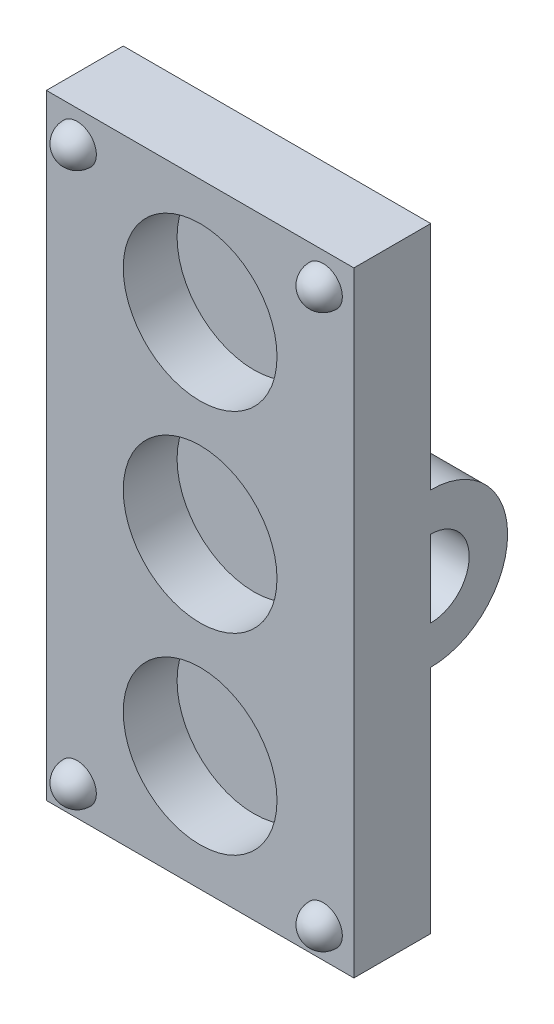
from build123d import *

# Parameters (mm, degrees)
SKETCH3_W           = 40
SKETCH3_H           = 80
BOSS_EXTRUDE1_DEPTH = 10
SKETCH4_R           = 10
CUT_EXTRUDE4_DEPTH  = 7
BOSS_EXTRUDE3_DEPTH = 40
CUT_EXTRUDE5_DEPTH  = 40


with BuildPart() as part:
    # Sketch3 → Boss-Extrude1 (new body)
    with BuildSketch(Plane.XY):
        Rectangle(SKETCH3_W, SKETCH3_H)
    extrude(amount=BOSS_EXTRUDE1_DEPTH)

    # Sketch4 → Cut-Extrude4 (cut)
    with BuildSketch(Plane.XY.offset(10)):
        with Locations((0, 25)):
            Circle(SKETCH4_R)
        Circle(SKETCH4_R)
        with Locations((0, -25)):
            Circle(SKETCH4_R)
    extrude(amount=-CUT_EXTRUDE4_DEPTH, mode=Mode.SUBTRACT)

    # Sketch5 → Revolve1 (revolve)
    with BuildSketch(Plane.XY.offset(10)):
        with BuildLine():
            Line((16, 38.5), (16, 33.5))
            ThreePointArc((16, 33.5), (13.5, 36), (16, 38.5))
        make_face()
    revolve(axis=Axis((16, 38.5, 10), (0, -1, 0)))

    # Sketch7 → Revolve2 (revolve)
    with BuildSketch(Plane.XY.offset(10)):
        with BuildLine():
            Line((-16, -33.5), (-16, -38.5))
            ThreePointArc((-16, -38.5), (-18.5, -36), (-16, -33.5))
        make_face()
        with BuildLine():
            Line((-16, 38.5), (-16, 33.5))
            ThreePointArc((-16, 33.5), (-18.5, 36), (-16, 38.5))
        make_face()
    revolve(axis=Axis((-16, -33.5, 10), (0, -1, 0)))

    # Sketch8 → Revolve3 (revolve)
    with BuildSketch(Plane.XY.offset(10)):
        with BuildLine():
            Line((16, -33.5), (16, -38.5))
            ThreePointArc((16, -38.5), (13.5, -36), (16, -33.5))
        make_face()
    revolve(axis=Axis((16, -33.5, 10), (0, -1, 0)))

    # Sketch12 → Boss-Extrude3 (add)
    with BuildSketch(Plane.ZY.offset(20)):
        with BuildLine():
            Line((0, 10), (0, -10))
            ThreePointArc((0, -10), (-10, 0), (0, 10))
        make_face()
    extrude(amount=-BOSS_EXTRUDE3_DEPTH)

    # Sketch13 → Cut-Extrude5 (cut)
    with BuildSketch(Plane.ZY.offset(20)):
        with BuildLine():
            Line((0, 5), (0, -5))
            ThreePointArc((0, -5), (-5, 0), (0, 5))
        make_face()
    extrude(amount=-CUT_EXTRUDE5_DEPTH, mode=Mode.SUBTRACT)


solid = part.part
